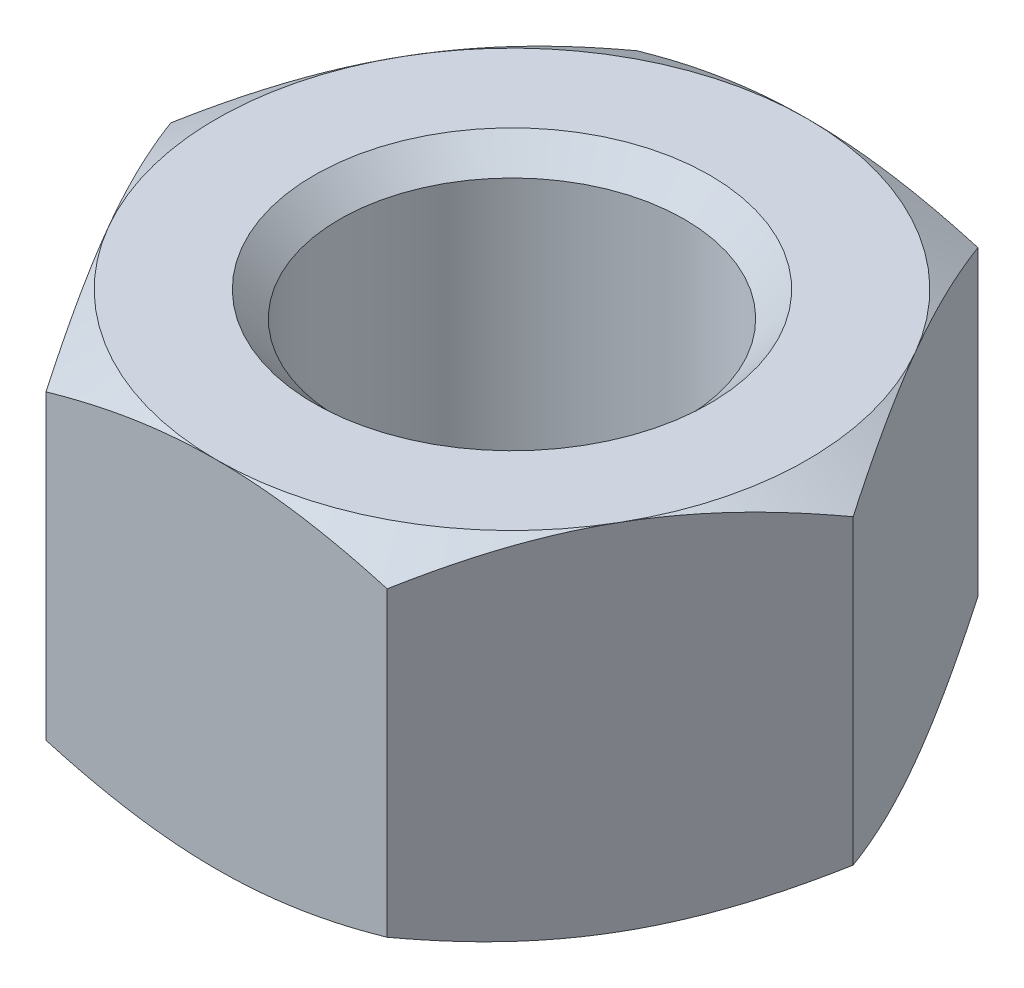
from build123d import *

# Parameters (mm, degrees)
EXTRUDE_1_DEPTH = 10.8


with BuildPart() as part:
    # Эскиз1 → Бобышка-Вытянуть1 (new body)
    with BuildSketch(Plane(origin=(0, 0, 0), x_dir=(1, 0, 0), z_dir=(0, 1, 0))):
        Polygon((-5.196152423, 9), (-10.392304845, 0), (-5.196152423, -9), (5.196152423, -9), (10.392304845, 0), (5.196152423, 9), align=None)
    extrude(amount=EXTRUDE_1_DEPTH)

    # Эскиз2 → Вырез-Повернуть1 (revolve, cut)
    with BuildSketch(Plane(origin=(0, 0, 0), x_dir=(0, 0, -1), z_dir=(1, 0, 0))):
        Polygon((-9, 10.8), (-10.47, 10.8), (-10.47, 9.951295104), align=None)
        Polygon((-9, 0), (-10.47, 0), (-10.47, 0.848704896), align=None)
    revolve(axis=Axis((0, -1000, 0), (0, 1, 0)), mode=Mode.SUBTRACT)

    # Эскиз3 → Отверстие обработанное метчиком M12x1.51 (revolve, cut)
    with BuildSketch(Plane(origin=(0, 0, 0), x_dir=(0, 0, -1), z_dir=(1, 0, 0))):
        Polygon((0, 0), (0, 10.8), (6.025, 10.8), (5.25, 10.025), (5.25, 0.775), (6.025, 0), align=None)
    revolve(axis=Axis((0, -6.35, 0), (0, 1, 0)), mode=Mode.SUBTRACT)


solid = part.part
